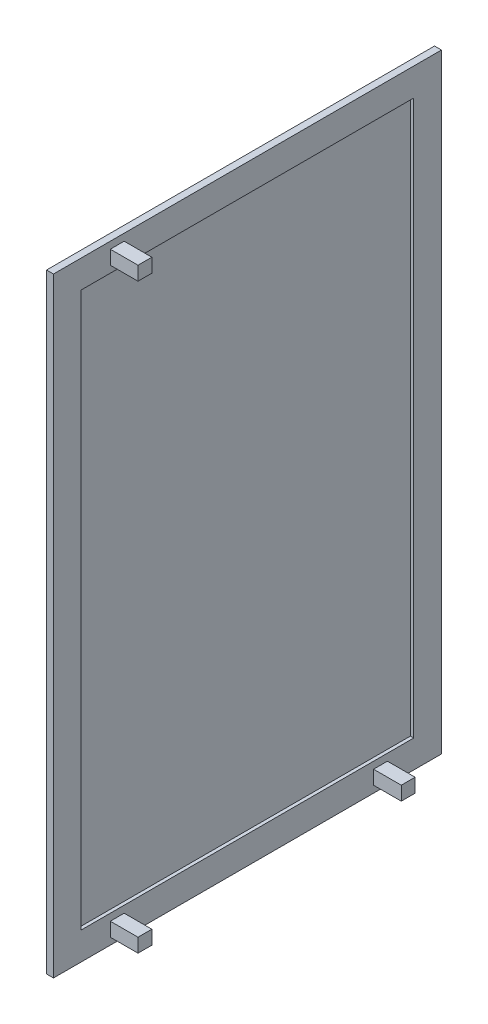
from build123d import *

# Parameters (mm, degrees)
SKETCH1_W           = 70
SKETCH1_H           = 110
BOSS_EXTRUDE1_DEPTH = 1.25
SKETCH2_W           = 2.5
SKETCH2_H           = 2.5
BOSS_EXTRUDE2_DEPTH = 5
SKETCH3_W           = 60
SKETCH3_H           = 100
CUT_EXTRUDE1_DEPTH  = 0.6


with BuildPart() as part:
    # Sketch1 → Boss-Extrude1 (new body)
    with BuildSketch(Plane(origin=(0, 0, 0), x_dir=(0, 0, -1), z_dir=(1, 0, 0))):
        with Locations((35, 55)):
            Rectangle(SKETCH1_W, SKETCH1_H)
    extrude(amount=BOSS_EXTRUDE1_DEPTH)

    # Sketch2 → Boss-Extrude2 (add)
    with BuildSketch(Plane(origin=(1.25, 0, 0), x_dir=(0, 0, -1), z_dir=(1, 0, 0))):
        with Locations((11.5, 107.5)):
            Rectangle(SKETCH2_W, SKETCH2_H)
        with Locations((11.5, 2.5)):
            Rectangle(SKETCH2_W, SKETCH2_H)
        with Locations((59, 2.5)):
            Rectangle(SKETCH2_W, SKETCH2_H)
    extrude(amount=BOSS_EXTRUDE2_DEPTH)

    # Sketch3 → Cut-Extrude1 (cut)
    with BuildSketch(Plane(origin=(1.25, 0, 0), x_dir=(0, 0, -1), z_dir=(1, 0, 0))):
        with Locations((35, 55)):
            Rectangle(SKETCH3_W, SKETCH3_H)
    extrude(amount=-CUT_EXTRUDE1_DEPTH, mode=Mode.SUBTRACT)


solid = part.part
